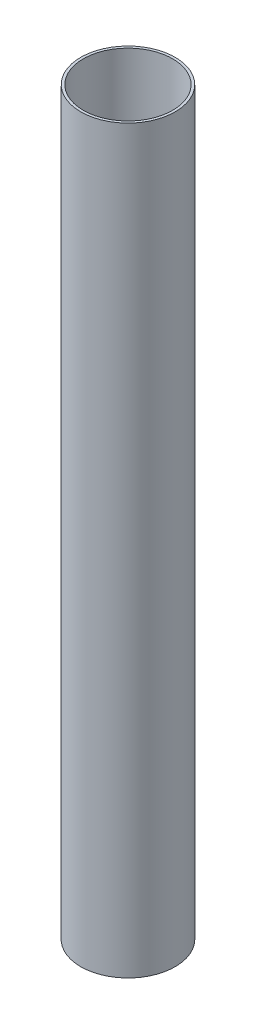
from build123d import *

# Parameters (mm, degrees)
SKETCH1_R   = 46.99
SKETCH1_R_2 = 44.45


with BuildPart() as part:
    # Sweep1: sweep along a curve in space
    with BuildLine() as sweep1_path:
        Line((0, 0, 0), (0, 736.6, 0))
    # Sketch1 → Sweep1 (sweep)
    with BuildSketch(Plane(origin=(0, 0, 0), x_dir=(1, 0, 0), z_dir=(0, 1, 0))):
        Circle(SKETCH1_R)
        Circle(SKETCH1_R_2, mode=Mode.SUBTRACT)
    sweep(path=sweep1_path.line)


solid = part.part
